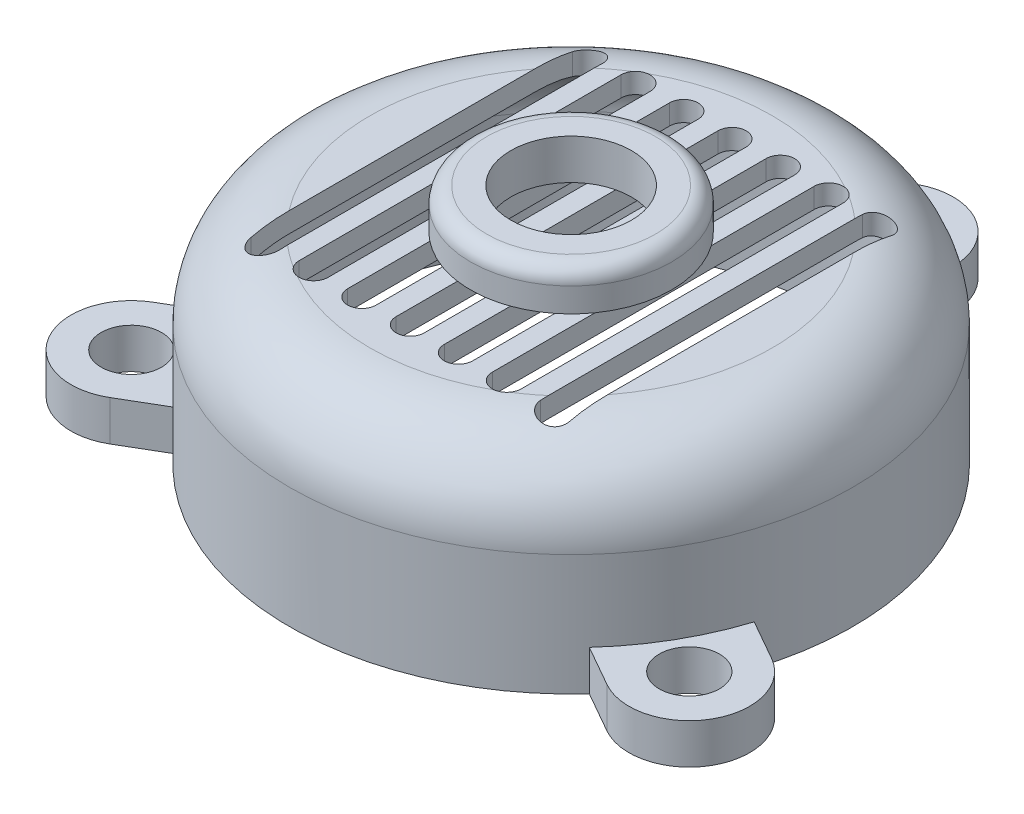
from build123d import *

# Parameters (mm, degrees)
SKETCH1_R           = 3.5
BOSS_EXTRUDE1_DEPTH = 1.25
FILLET1_R           = 1
SHELL1_T            = -0.25
CUT_EXTRUDE2_DEPTH  = 10
SKETCH4_R           = 1.25
SKETCH4_R_2         = 0.75
BOSS_EXTRUDE2_DEPTH = 0.5
FILLET2_R           = 0.2
BOSS_EXTRUDE3_START = -0.5
SKETCH5_R           = 0.375
BOSS_EXTRUDE3_DEPTH = 0.5
CIRPATTERN1_COUNT   = 3


with BuildPart() as part:
    # Sketch1 → Boss-Extrude1 (new, symmetric)
    with BuildSketch(Plane(origin=(0, 0, 0), x_dir=(1, 0, 0), z_dir=(0, 1, 0))):
        with Locations(Location((0, 0, 0), (0, 0, 270))):
            Circle(SKETCH1_R)
    extrude(amount=BOSS_EXTRUDE1_DEPTH, both=True)

    # Fillet1
    fillet1_edges = [part.edges().sort_by_distance(p)[0] for p in [
        (0, 1.25, -3.5),
    ]]
    fillet(fillet1_edges, radius=FILLET1_R)

    # Shell1
    shell1_openings = [part.faces().sort_by_distance(p)[0] for p in [
        (0, -1.25, 0),
    ]]
    offset(amount=SHELL1_T, openings=shell1_openings, kind=Kind.INTERSECTION)

    # Sketch2 → Cut-Extrude2 (cut)
    with BuildSketch(Plane(origin=(0, 1.25, 0), x_dir=(1, 0, 0), z_dir=(0, 1, 0))):
        with BuildLine():
            Line((0.175, 2), (0.175, -2))
            ThreePointArc((0.175, -2), (0, -2.175), (-0.175, -2))
            Line((-0.175, -2), (-0.175, 2))
            ThreePointArc((-0.175, 2), (0, 2.175), (0.175, 2))
        make_face()
        with BuildLine():
            Line((0.776803156, 2), (0.776803156, -2))
            ThreePointArc((0.776803156, -2), (0.6, -2.176803156), (0.423196844, -2))
            Line((0.423196844, -2), (0.423196844, 2))
            ThreePointArc((0.423196844, 2), (0.6, 2.176803156), (0.776803156, 2))
        make_face()
        with BuildLine():
            Line((1.38, 2), (1.38, -2))
            ThreePointArc((1.38, -2), (1.2, -2.18), (1.02, -2))
            Line((1.02, -2), (1.02, 2))
            ThreePointArc((1.02, 2), (1.2, 2.18), (1.38, 2))
        make_face()
        with BuildLine():
            Line((1.98, 2), (1.98, -2))
            ThreePointArc((1.98, -2), (1.8, -2.18), (1.62, -2))
            Line((1.62, -2), (1.62, 2))
            ThreePointArc((1.62, 2), (1.8, 2.18), (1.98, 2))
        make_face()
    cut_extrude2 = extrude(amount=-CUT_EXTRUDE2_DEPTH, mode=Mode.SUBTRACT)

    # Mirror1: Cut-Extrude2 across plane
    add(cut_extrude2.mirror(Plane(origin=(0, 0, 0), x_dir=(0, 0, 1), z_dir=(1, 0, 0))), mode=Mode.SUBTRACT)

    # Sketch4 → Boss-Extrude2 (add)
    with BuildSketch(Plane(origin=(0, 1.25, 0), x_dir=(1, 0, 0), z_dir=(0, 1, 0))):
        with Locations(Location((0, 0, 0), (0, 0, 81.952153753))):
            Circle(SKETCH4_R)
        with Locations(Location((0, 0, 0), (0, 0, 76.506601178))):
            Circle(SKETCH4_R_2, mode=Mode.SUBTRACT)
    extrude(amount=BOSS_EXTRUDE2_DEPTH)

    # Fillet2
    fillet2_edges = [part.edges().sort_by_distance(p)[0] for p in [
        (-0.175, 1.75, 1.237689379),
    ]]
    fillet(fillet2_edges, radius=FILLET2_R)

    # Sketch5 → Boss-Extrude3 (add)
    with BuildSketch(Plane.XZ.offset(1.25).offset(BOSS_EXTRUDE3_START)):
        with BuildLine():
            Line((3.335498429, 1.060400975), (3.83647794, 1.345350126))
            ThreePointArc((3.83647794, 1.345350126), (4.117597851, 2.368077654), (3.094870323, 2.649197565))
            Line((3.094870323, 2.649197565), (2.585253454, 2.359335622))
            ThreePointArc((2.585253454, 2.359335622), (3.030781008, 1.750533199), (3.335498429, 1.060400975))
        make_face()
        with Locations(Location((3.465674131, 1.997273846, 0), (0, 0, 270))):
            Circle(SKETCH5_R, mode=Mode.SUBTRACT)
    boss_extrude3 = extrude(amount=BOSS_EXTRUDE3_DEPTH)

    # CirPattern1: Boss-Extrude3 ×3 about axis
    cirpattern1_axis = Axis((0, 0, 0), (0, 1, 0))
    for i in range(1, CIRPATTERN1_COUNT):
        add(boss_extrude3.rotate(cirpattern1_axis, i * 360 / CIRPATTERN1_COUNT))


solid = part.part
